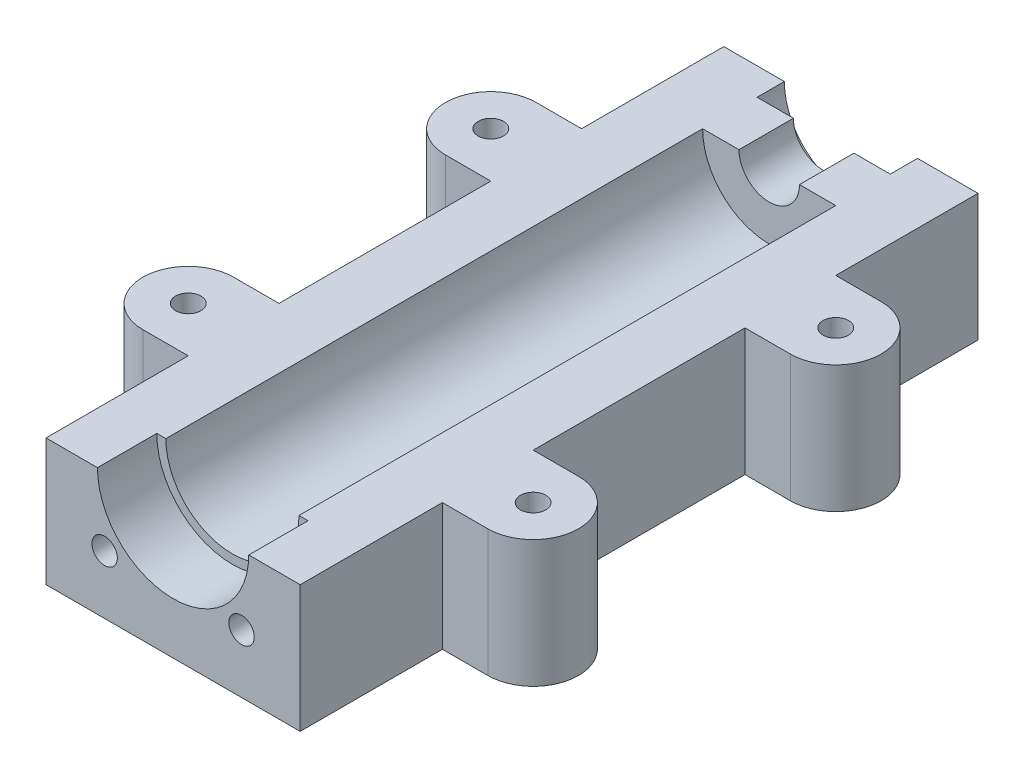
from build123d import *

# Parameters (mm, degrees)
SKETCH_1_W               = 21
SKETCH_1_H               = 112
CUT_EXTRUDE_1_REACH      = 117.871
SKETCH_3_W               = 42
SKETCH_3_H               = 25
EXTRUDE_1_REACH          = 117.871
SKETCH_4_W               = 42
SKETCH_4_H               = 112
EXTRUDE_2_DEPTH          = 21
HOLE_WIZARD_M51_D        = 4.2
PATTERN_LINEAR_1_COUNT   = 2
PATTERN_LINEAR_1_PITCH   = 50
MIRROR_1_COPY_1_DEPTH    = 21
MIRROR_1_COPY_2_D        = 4.2
PATTERN_CIRCULAR_1_COUNT = 2
PATTERN_CIRCULAR_1_ANGLE = 90


with BuildPart() as part:
    # Эскиз1 → Повернуть1 (revolve)
    with BuildSketch(Plane(origin=(0, 0, 0), x_dir=(1, 0, 0), z_dir=(0, 1, 0))):
        with Locations((10.5, 56)):
            Rectangle(SKETCH_1_W, SKETCH_1_H)
    revolve(axis=Axis((0, 0, 0), (0, 0, -1)))

    # Эскиз2 → Вырез-Повернуть1 (revolve, cut)
    with BuildSketch(Plane(origin=(0, 0, 0), x_dir=(1, 0, 0), z_dir=(0, 1, 0)), mode=Mode.PRIVATE) as cut_revolve_1_sk:
        Polygon((0, 0), (12.5, 0), (12.5, 9.8), (11, 9.8), (11, 98.5), (5, 98.5), (5, 107.5), (11, 107.5), (11, 112), (0, 112), align=None)
    revolve(cut_revolve_1_sk.sketch.rotate(Axis((0, 0, -112), (0, 0, 1)), 180), axis=Axis((0, 0, -112), (0, 0, 1)), mode=Mode.SUBTRACT)

    # Вырез-Вытянуть1: up to this face of the body (flat: up to its plane)
    cut_extrude_1_end = Plane(part.part.faces().sort_by_distance((-20.406030304, 0, -112))[0])
    # Эскиз3 → Вырез-Вытянуть1 (cut, up to the picked face)
    with BuildSketch(Plane.XY, mode=Mode.PRIVATE) as cut_extrude_1_sk1:
        with Locations((0, 12.5)):
            Rectangle(SKETCH_3_W, SKETCH_3_H)
    cut_extrude_1_tool1 = split(extrude(cut_extrude_1_sk1.sketch, amount=-CUT_EXTRUDE_1_REACH, mode=Mode.PRIVATE), bisect_by=cut_extrude_1_end, keep=Keep.BOTH, mode=Mode.PRIVATE)
    add(cut_extrude_1_tool1.solids().sort_by(Axis((0, 12.5, 0), (0, 0, -1)))[0], mode=Mode.SUBTRACT)

    # Эскиз4 → Бобышка-Вытянуть1 (add, up to next)
    with BuildSketch(Plane(origin=(0, -21, 0), x_dir=(1, 0, 0), z_dir=(0, 1, 0)), mode=Mode.PRIVATE) as extrude_1_sk1:
        with Locations((0, 56)):
            Rectangle(SKETCH_4_W, SKETCH_4_H)
    extrude_1_tool1 = extrude(extrude_1_sk1.sketch, amount=EXTRUDE_1_REACH, mode=Mode.PRIVATE) - part.part
    add(extrude_1_tool1.solids().sort_by_distance((0, -21, -56))[0])
    add(extrude_1_tool1.solids().sort_by_distance((0, -21, -56))[1])

    # Эскиз5 → Бобышка-Вытянуть2 (add)
    with BuildSketch(Plane(origin=(0, -21, 0), x_dir=(1, 0, 0), z_dir=(0, 1, 0))):
        with BuildLine():
            Line((21, 23.5), (28.5, 23.5))
            ThreePointArc((28.5, 23.5), (36, 31), (28.5, 38.5))
            Line((28.5, 38.5), (21, 38.5))
            Line((21, 38.5), (21, 23.5))
        make_face()
    extrude_2 = extrude(amount=EXTRUDE_2_DEPTH)

    # Сверление под метчик M51 (through all)
    with Locations(Plane(origin=(28.5, 0, -31), x_dir=(0, 0, 1), z_dir=(0, 1, 0))):
        with Locations((0, 0)):
            hole_wizard_m51 = Hole(HOLE_WIZARD_M51_D / 2)

    # Линейный массив1: Бобышка-Вытянуть2, Сверление под метчик M51 ×2
    with Locations(*[(0, 0, -i * PATTERN_LINEAR_1_PITCH) for i in range(1, PATTERN_LINEAR_1_COUNT)]):
        add(extrude_2)
        add(hole_wizard_m51, mode=Mode.SUBTRACT)

    # Зеркальное отражение1: Бобышка-Вытянуть2, Сверление под метчик M51 across plane
    add(extrude_2.mirror(Plane(origin=(0, 0, 0), x_dir=(0, 0, 1), z_dir=(1, 0, 0))))
    add(hole_wizard_m51.mirror(Plane(origin=(0, 0, 0), x_dir=(0, 0, 1), z_dir=(1, 0, 0))), mode=Mode.SUBTRACT)

    # Зеркальное отражение1 copy 1 sketch → Зеркальное отражение1 copy 1 (add)
    with BuildSketch(Plane(origin=(0, -21, -50), x_dir=(-1, 0, 0), z_dir=(0, 1, 0))):
        with BuildLine():
            Line((21, -23.5), (28.5, -23.5))
            ThreePointArc((28.5, -23.5), (36, -31), (28.5, -38.5))
            Line((28.5, -38.5), (21, -38.5))
            Line((21, -38.5), (21, -23.5))
        make_face()
    extrude(amount=MIRROR_1_COPY_1_DEPTH)

    # Зеркальное отражение1 copy 2 (through all)
    with Locations(Plane(origin=(-28.5, 0, -81), x_dir=(0, 0, 1), z_dir=(0, 1, 0))):
        with Locations((0, 0)):
            Hole(MIRROR_1_COPY_2_D / 2)

    # Эскиз8 → Сверление под метчик M52 (revolve, cut)
    with BuildSketch(Plane(origin=(11.313708499, -11.313708499, 0), x_dir=(0, -1, 0), z_dir=(1, 0, 0))):
        Polygon((0, 0), (0, 26.2618073), (2.1, 25), (2.1, 0), align=None)
    hole_wizard_m52 = revolve(axis=Axis((11.313708499, -11.313708499, 6.35), (0, 0, -1)), mode=Mode.SUBTRACT)

    # Круговой массив1: Сверление под метчик M52 ×2 about axis
    pattern_circular_1_axis = Axis((0, 0, 0), (0, 0, -1))
    for i in range(1, PATTERN_CIRCULAR_1_COUNT):
        add(hole_wizard_m52.rotate(pattern_circular_1_axis, i * PATTERN_CIRCULAR_1_ANGLE / (PATTERN_CIRCULAR_1_COUNT - 1)), mode=Mode.SUBTRACT)

    # Зеркальное отражение2: Сверление под метчик M52 across plane
    add(hole_wizard_m52.mirror(Plane.XY.offset(-56)), mode=Mode.SUBTRACT)

    # Зеркальное отражение2 copy 1 sketch → Зеркальное отражение2 copy 1 (revolve, cut)
    with BuildSketch(Plane(origin=(-11.313708499, -11.313708499, -112), x_dir=(-1, 0, 0), z_dir=(0, -1, 0))):
        Polygon((0, 0), (0, -26.2618073), (2.1, -25), (2.1, 0), align=None)
    revolve(axis=Axis((-11.313708499, -11.313708499, -118.35), (0, 0, -1)), mode=Mode.SUBTRACT)


solid = part.part
